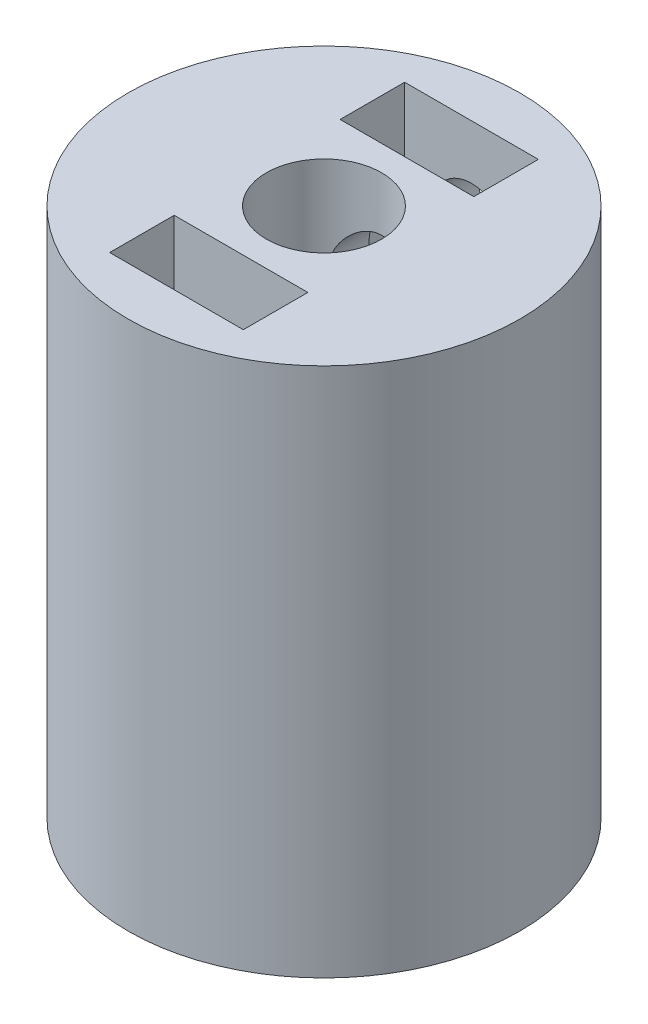
from build123d import *

# Parameters (mm, degrees)
SKETCH1_R           = 8.5
SKETCH1_R_2         = 2.5
BOSS_EXTRUDE1_DEPTH = 23
SKETCH3_W           = 5.8
SKETCH3_H           = 2.8
CUT_EXTRUDE2_DEPTH  = 8
SKETCH7_W           = 5.8
SKETCH7_H           = 2.8
CUT_EXTRUDE5_DEPTH  = 8
SKETCH4_R           = 1.65
CUT_EXTRUDE3_DEPTH  = 26.951878545


with BuildPart() as part:
    # Sketch1 → Boss-Extrude1 (new body)
    with BuildSketch(Plane(origin=(0, 0, 0), x_dir=(1, 0, 0), z_dir=(0, 1, 0))):
        with Locations(Location((0, 0, 0), (0, 0, 270))):
            Circle(SKETCH1_R)
        with Locations(Location((0, 0, 0), (0, 0, 270))):
            Circle(SKETCH1_R_2, mode=Mode.SUBTRACT)
    extrude(amount=BOSS_EXTRUDE1_DEPTH)

    # Sketch3 → Cut-Extrude2 (cut)
    with BuildSketch(Plane(origin=(0, 23, 0), x_dir=(1, 0, 0), z_dir=(0, 1, 0))):
        with Locations((0, 5)):
            Rectangle(SKETCH3_W, SKETCH3_H)
    cut_extrude2 = extrude(amount=-CUT_EXTRUDE2_DEPTH, mode=Mode.SUBTRACT)

    # Sketch7 → Cut-Extrude5 (cut)
    with BuildSketch(Plane.XZ):
        with Locations((0, -5.5)):
            Rectangle(SKETCH7_W, SKETCH7_H)
    extrude(amount=-CUT_EXTRUDE5_DEPTH, mode=Mode.SUBTRACT)

    # Sketch4 → Cut-Extrude3 (cut, through all)
    with BuildSketch(Plane.XY):
        with Locations(Location((0, 19, 0), (0, 0, 90))):
            Circle(SKETCH4_R)
        with Locations((0, 4)):
            Circle(SKETCH4_R)
    extrude(amount=-CUT_EXTRUDE3_DEPTH, mode=Mode.SUBTRACT)

    # Mirror1: Cut-Extrude2 across plane
    add(cut_extrude2.mirror(Plane.XY), mode=Mode.SUBTRACT)


solid = part.part
